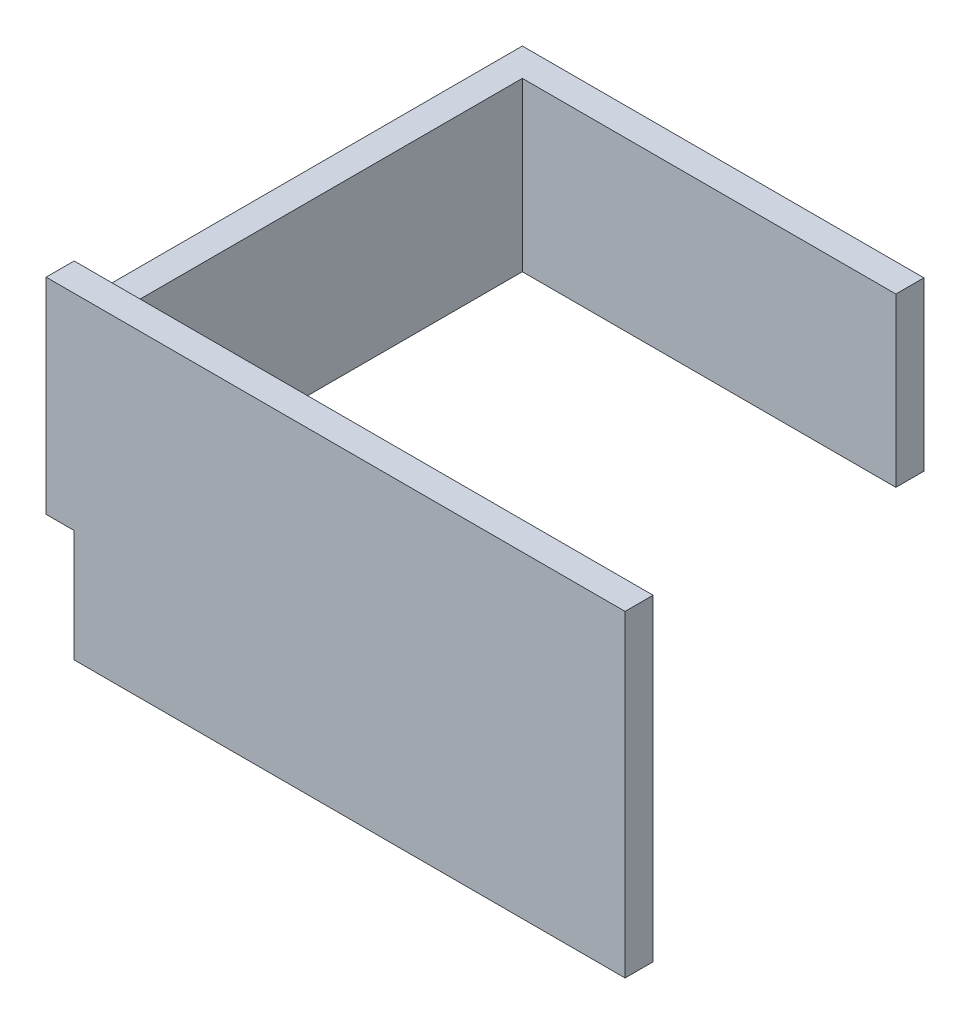
from build123d import *

# Parameters (mm, degrees)
SKETCH_1_W          = 59
SKETCH_1_H          = 3
EXTRUDE_1_DEPTH     = 34
SKETCH_2_W          = 3
SKETCH_2_H          = 48
EXTRUDE_2_DEPTH     = 22
SKETCH_3_W          = 43
SKETCH_3_H          = 3
EXTRUDE_3_DEPTH     = 22
SKETCH_4_W          = 48
SKETCH_4_H          = 4.064402022
CUT_EXTRUDE_1_DEPTH = 89


with BuildPart() as part:
    # 草图1 → 凸台-拉伸1 (new body)
    with BuildSketch(Plane(origin=(0, 0, 0), x_dir=(1, 0, 0), z_dir=(0, 1, 0))):
        with Locations((29.5, -1.5)):
            Rectangle(SKETCH_1_W, SKETCH_1_H)
    extrude(amount=EXTRUDE_1_DEPTH)

    # 草图2 → 凸台-拉伸2 (add)
    with BuildSketch(Plane(origin=(0, 34, 0), x_dir=(1, 0, 0), z_dir=(0, 1, 0))):
        with Locations((-1.5, 21)):
            Rectangle(SKETCH_2_W, SKETCH_2_H)
    extrude(amount=-EXTRUDE_2_DEPTH)

    # 草图3 → 凸台-拉伸3 (add)
    with BuildSketch(Plane(origin=(0, 34, 0), x_dir=(1, 0, 0), z_dir=(0, 1, 0))):
        with Locations((18.5, 46.5)):
            Rectangle(SKETCH_3_W, SKETCH_3_H)
    extrude(amount=-EXTRUDE_3_DEPTH)

    # 草图4 → 切除-拉伸1 (cut)
    with BuildSketch(Plane(origin=(40, 0, 0), x_dir=(0, 0, -1), z_dir=(1, 0, 0))):
        with Locations((24, 31.967798989)):
            Rectangle(SKETCH_4_W, SKETCH_4_H)
    extrude(amount=-CUT_EXTRUDE_1_DEPTH, mode=Mode.SUBTRACT)


solid = part.part
